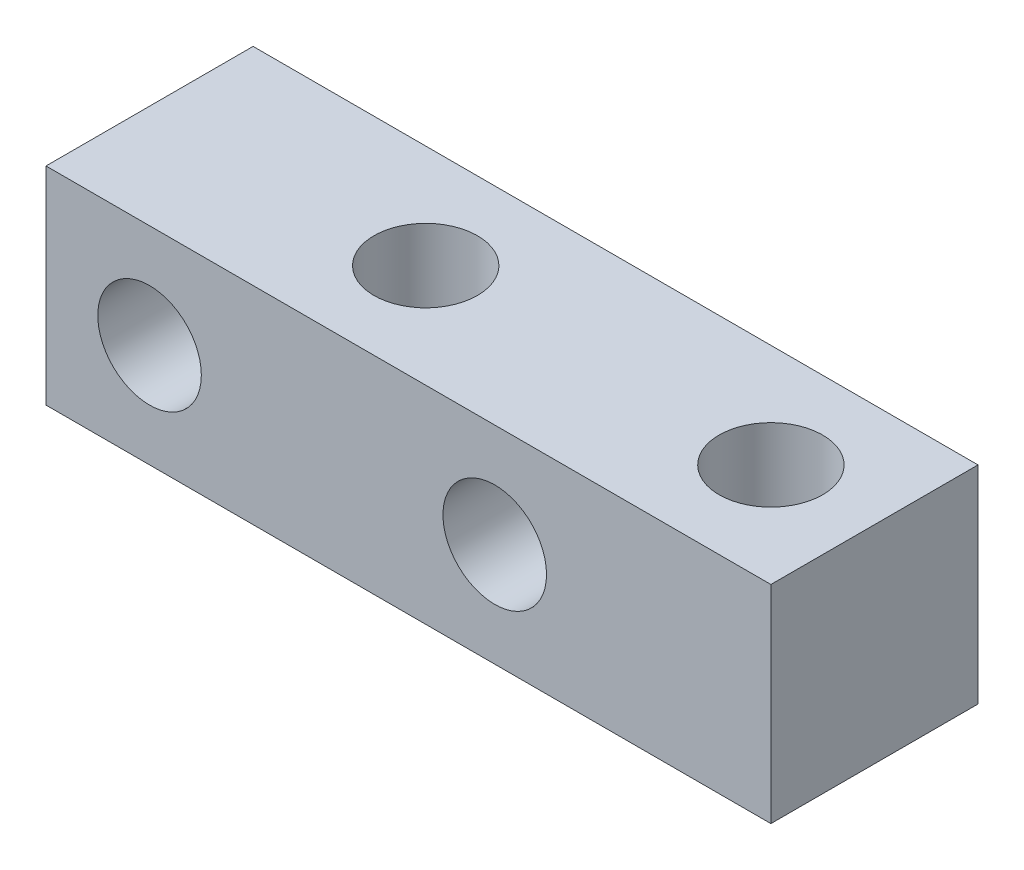
from build123d import *

# Parameters (mm, degrees)
SKETCH_1_W          = 21
SKETCH_1_H          = 6
SKETCH_1_R          = 1.5
EXTRUDE_1_DEPTH     = 6
SKETCH_2_R          = 1.5
CUT_EXTRUDE_1_DEPTH = 6


with BuildPart() as part:
    # 草图1 → 凸台-拉伸1 (new body)
    with BuildSketch(Plane.XY):
        with Locations((-1.993584836, 4.991617994)):
            Rectangle(SKETCH_1_W, SKETCH_1_H)
        with Locations((-9.493584836, 4.991617994)):
            Circle(SKETCH_1_R, mode=Mode.SUBTRACT)
        with Locations((0.506415164, 4.991617994)):
            Circle(SKETCH_1_R, mode=Mode.SUBTRACT)
    extrude(amount=EXTRUDE_1_DEPTH)

    # 草图2 → 切除-拉伸1 (cut)
    with BuildSketch(Plane.XZ.offset(-1.991617994)):
        with Locations((5.506415164, 3)):
            Circle(SKETCH_2_R)
        with Locations((-4.493584836, 3)):
            Circle(SKETCH_2_R)
    extrude(amount=-CUT_EXTRUDE_1_DEPTH, mode=Mode.SUBTRACT)


solid = part.part
